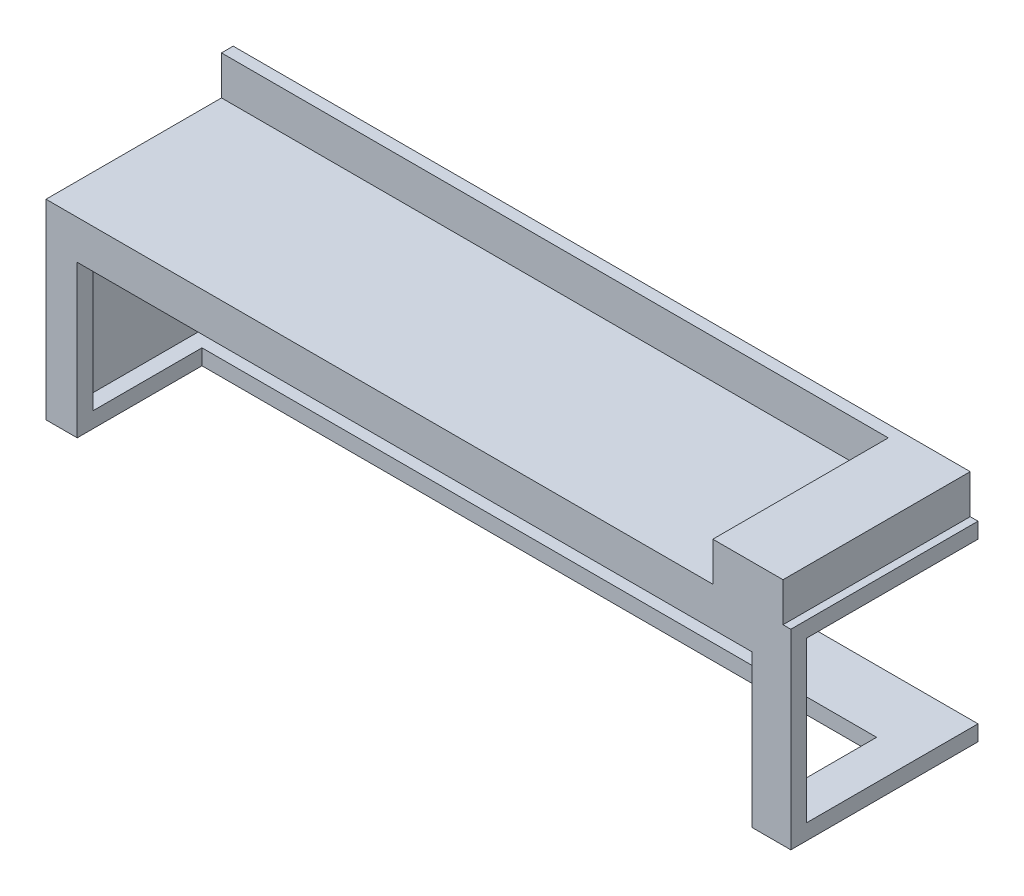
from build123d import *

# Parameters (mm, degrees)
EXTRUDE_1_DEPTH          = 8
EXTRUDE_3_DEPTH          = 14
CUT_EXTRUDE_1_DEPTH      = 55.485089704
CUT_EXTRUDE_1_DEPTH_BACK = 55.485089704
SKETCH_4_W               = 2
SKETCH_4_H               = 24.5
SKETCH_7_W               = 2
SKETCH_7_H               = 2
SKETCH_7_W_2             = 5
EXTRUDE_6_DEPTH          = 14
EXTRUDE_4_DEPTH          = 2
SKETCH_8_W               = 85.5
SKETCH_8_H               = 1.5
EXTRUDE_7_DEPTH          = 5


with BuildPart() as part:
    # Эскиз1 → Бобышка-Вытянуть1 (new body)
    with BuildSketch(Plane.XY):
        Polygon((47.75, 12.25), (44.75, 12.25), (44.75, 17.25), (35.75, 17.25), (35.75, 12.25), (-49.75, 12.25), (-49.75, -12.25), (47.75, -12.25), (47.75, -10.25), (-47.75, -10.25), (-47.75, 10.25), (38.75, 10.25), (38.75, 15.25), (41.75, 15.25), (41.75, 12.25), (41.75, 10.25), (47.75, 10.25), align=None)
    extrude(amount=EXTRUDE_1_DEPTH)

    # Эскиз2 → Бобышка-Вытянуть3 (add)
    with BuildSketch(Plane.XY.offset(8)):
        Polygon((44.75, 10.25), (47.75, 10.25), (47.75, 12.25), (44.75, 12.25), (44.75, 15.25), (44.75, 17.25), (41.75, 17.25), (35.75, 17.25), (35.75, 15.25), (35.75, 12.25), (-47.75, 12.25), (-49.75, 12.25), (-49.75, 10.25), (-49.75, -10.25), (-49.75, -12.25), (-47.75, -12.25), (-47.75, -10.25), (-47.75, 10.25), (35.75, 10.25), (38.75, 10.25), (38.75, 12.25), (38.75, 15.25), (41.75, 15.25), (41.75, 10.25), align=None)
    extrude(amount=EXTRUDE_3_DEPTH)

    # Эскиз4 → Вырез-Вытянуть1 (cut, two sides: drawn at the far end of the back side and taken through both)
    with BuildSketch(Plane.XY.offset(8).offset(-CUT_EXTRUDE_1_DEPTH_BACK)):
        with Locations((46.75, 0)):
            Rectangle(SKETCH_4_W, SKETCH_4_H)
    extrude(amount=CUT_EXTRUDE_1_DEPTH + CUT_EXTRUDE_1_DEPTH_BACK, mode=Mode.SUBTRACT)

    # Эскиз7 → Бобышка-Вытянуть6 (add)
    with BuildSketch(Plane.XY.offset(8)):
        with Locations((-46.75, -11.25)):
            Rectangle(SKETCH_7_W, SKETCH_7_H)
        with Locations((43.25, -11.25)):
            Rectangle(SKETCH_7_W_2, SKETCH_7_H)
    extrude(amount=EXTRUDE_6_DEPTH)

    # Эскиз5 → Бобышка-Вытянуть4 (add)
    with BuildSketch(Plane.XY.offset(22)):
        Polygon((45.75, -12.25), (40.75, -12.25), (40.75, 7.25), (-45.75, 7.25), (-45.75, -12.25), (-49.75, -12.25), (-49.75, 12.25), (35.75, 12.25), (35.75, 17.25), (44.75, 17.25), (44.75, 12.25), (45.75, 12.25), align=None)
    extrude(amount=EXTRUDE_4_DEPTH)

    # Эскиз8 → Бобышка-Вытянуть7 (add)
    with BuildSketch(Plane(origin=(0, 12.25, 0), x_dir=(1, 0, 0), z_dir=(0, 1, 0))):
        with Locations((-7, -0.75)):
            Rectangle(SKETCH_8_W, SKETCH_8_H)
    extrude(amount=EXTRUDE_7_DEPTH)


solid = part.part
